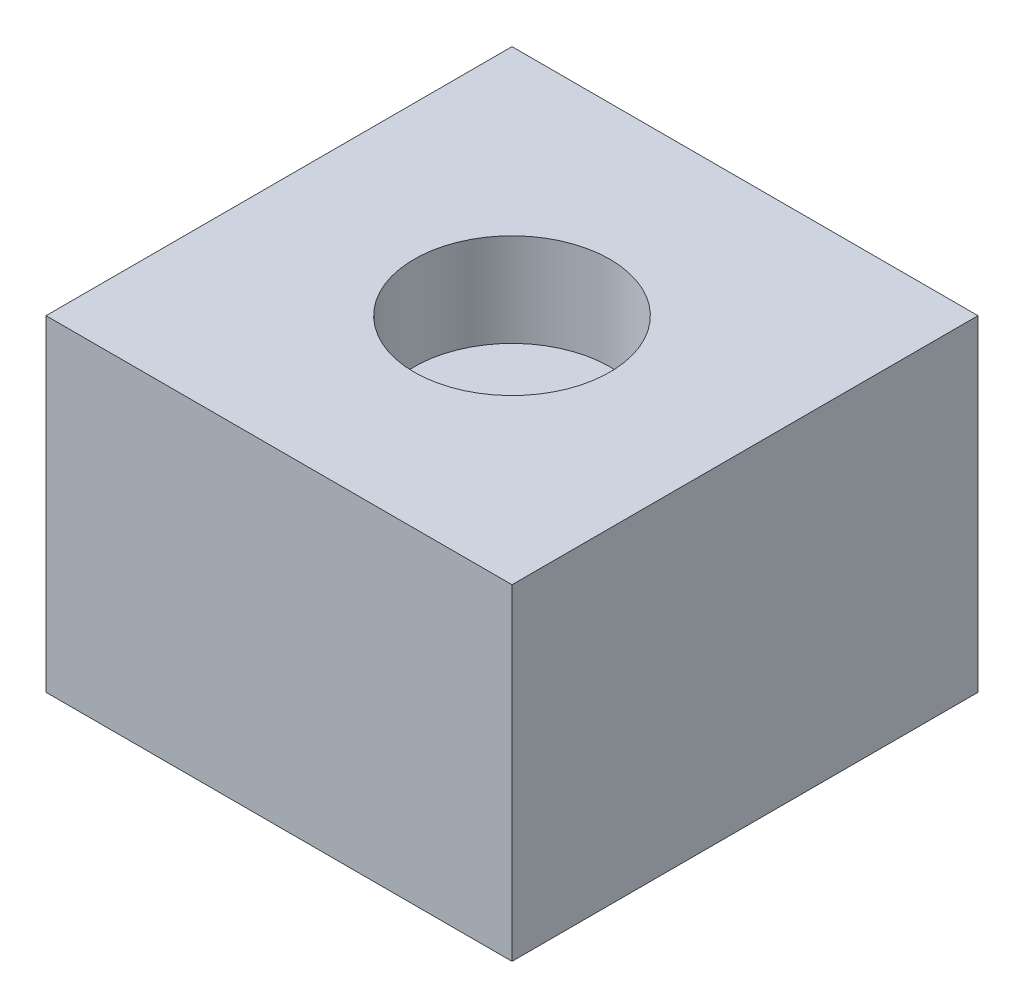
from build123d import *

# Parameters (mm, degrees)
SKETCH1_W           = 10
SKETCH1_H           = 10
BOSS_EXTRUDE1_DEPTH = 7
SKETCH2_R           = 2.1
CUT_EXTRUDE1_DEPTH  = 2


with BuildPart() as part:
    # Sketch1 → Boss-Extrude1 (new body)
    with BuildSketch(Plane(origin=(0, 0, 0), x_dir=(1, 0, 0), z_dir=(0, 1, 0))):
        with Locations((5, 5)):
            Rectangle(SKETCH1_W, SKETCH1_H)
    extrude(amount=BOSS_EXTRUDE1_DEPTH)

    # Sketch2 → Cut-Extrude1 (cut)
    with BuildSketch(Plane(origin=(0, 7, 0), x_dir=(1, 0, 0), z_dir=(0, 1, 0))):
        with Locations(Location((5, 5, 0), (0, 0, 270))):
            Circle(SKETCH2_R)
    extrude(amount=-CUT_EXTRUDE1_DEPTH, mode=Mode.SUBTRACT)


solid = part.part
